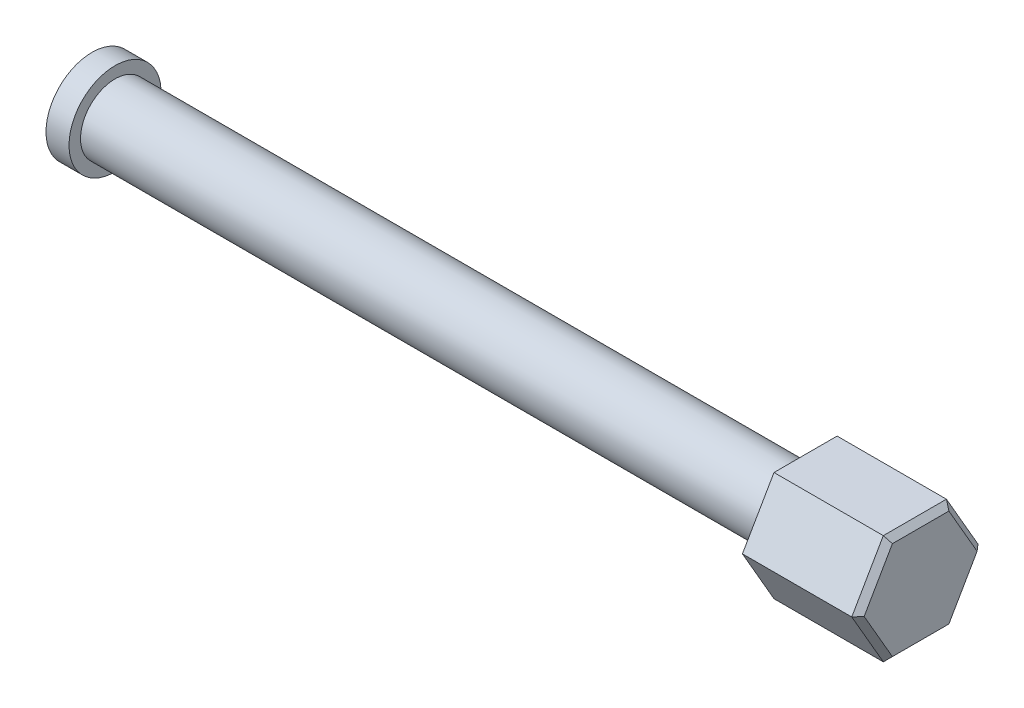
from build123d import *

# Parameters (mm, degrees)
SKETCH_2_OUTSIDE_W  = 53.464
SKETCH_2_OUTSIDE_H  = 53.464
CUT_EXTRUDE_1_DEPTH = 20
CHAMFER_1_SIZE      = 1
SKETCH_3_R          = 3
CUT_EXTRUDE_2_DEPTH = 3
CUT_EXTRUDE_2_DRAFT = -40


with BuildPart() as part:
    # Эскиз1 → Повернуть1 (revolve)
    with BuildSketch(Plane(origin=(0, 0, 0), x_dir=(1, 0, 0), z_dir=(0, 1, 0)), mode=Mode.PRIVATE) as revolve_1_sk:
        Polygon((-64.645142278, 0), (-64.645142278, 8), (-60.645142278, 8), (-60.645142278, 6), (59.354857722, 6), (59.354857722, 11), (79.354857722, 11), (79.354857722, 0), align=None)
    revolve(revolve_1_sk.sketch.rotate(Axis((-81.575248185, 0, 0), (1, 0, 0)), 180), axis=Axis((-81.575248185, 0, 0), (1, 0, 0)))

    # Эскиз2 outside → Вырез-Вытянуть1 (cut)
    with BuildSketch(Plane(origin=(79.354857722, 0, 0), x_dir=(0, 0, -1), z_dir=(1, 0, 0))):
        Rectangle(SKETCH_2_OUTSIDE_W, SKETCH_2_OUTSIDE_H)
        Polygon((10.969655115, 0), (5.484827557, 9.5), (-5.484827557, 9.5), (-10.969655115, 0), (-5.484827557, -9.5), (5.484827557, -9.5), align=None, mode=Mode.SUBTRACT)
    extrude(amount=-CUT_EXTRUDE_1_DEPTH, mode=Mode.SUBTRACT)

    # Фаска1
    chamfer_1_edges = [part.edges().sort_by_distance(p)[0] for p in [
        (79.354857722, -4.75, -8.227241336),
        (79.354857722, -9.5, 0),
        (79.354857722, -4.75, 8.227241336),
        (79.354857722, 4.75, 8.227241336),
        (79.354857722, 9.5, 0),
        (79.354857722, 4.75, -8.227241336),
    ]]
    chamfer(chamfer_1_edges, length=CHAMFER_1_SIZE)


with BuildPart() as cut_extrude_2_tool:
    # Эскиз3 → Вырез-Вытянуть2 (with draft: the straight prism first)
    with BuildSketch(Plane.ZY.offset(64.645142278)):
        Circle(SKETCH_3_R)
    extrude(amount=-CUT_EXTRUDE_2_DEPTH)
    # Вырез-Вытянуть2: the draft: its side faces are tilted about the plane it starts from
    cut_extrude_2_sides = [cut_extrude_2_tool.faces().sort_by_distance(p)[0] for p in [
        (-63.145142278, 0, -3),
    ]]
    draft(cut_extrude_2_sides, Plane.ZY.offset(64.645142278), CUT_EXTRUDE_2_DRAFT)


with BuildPart() as part_1:
    add(part.part)

    # Вырез-Вытянуть2: cut by cut_extrude_2_tool
    add(cut_extrude_2_tool.part, mode=Mode.SUBTRACT)


solid = part_1.part
